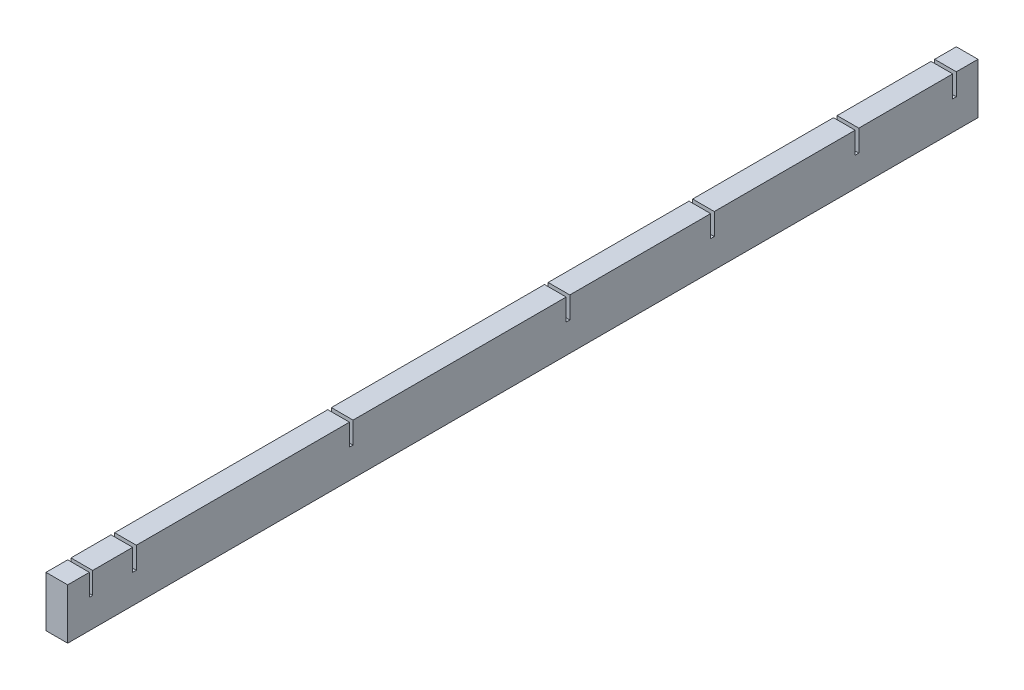
from build123d import *

# Parameters (mm, degrees)
BOSS_EXTRUDE1_DEPTH      = 1384.3
BOSS_EXTRUDE1_DEPTH_BACK = 215.9
SKETCH1_W                = 38.1
SKETCH1_H                = 88.9
SKETCH2_W                = 5.842
SKETCH2_H                = 38.1
SKETCH2_W_2              = 6.35
CUT_EXTRUDE1_DEPTH       = 1391.781379353


with BuildPart() as part:
    # Sketch1 → Boss-Extrude1 (new, two sides: drawn at the far end of the back side and taken through both)
    with BuildSketch(Plane.XY.offset(-BOSS_EXTRUDE1_DEPTH_BACK)):
        with Locations((0, 84.1375)):
            Rectangle(SKETCH1_W, SKETCH1_H)
    extrude(amount=BOSS_EXTRUDE1_DEPTH + BOSS_EXTRUDE1_DEPTH_BACK)

    # Sketch2 → Cut-Extrude1 (cut, through all)
    with BuildSketch(Plane(origin=(19.05, 0, 0), x_dir=(0, 0, -1), z_dir=(1, 0, 0))):
        with Locations((-1343.279, 109.5375)):
            Rectangle(SKETCH2_W, SKETCH2_H)
        with Locations((-1266.825, 109.5375)):
            Rectangle(SKETCH2_W_2, SKETCH2_H)
        with Locations((-885.825, 109.5375)):
            Rectangle(SKETCH2_W_2, SKETCH2_H)
        with Locations((-504.825, 109.5375)):
            Rectangle(SKETCH2_W_2, SKETCH2_H)
        with Locations((-250.825, 109.5375)):
            Rectangle(SKETCH2_W_2, SKETCH2_H)
        with Locations((3.175, 109.5375)):
            Rectangle(SKETCH2_W_2, SKETCH2_H)
        with Locations((174.625, 109.5375)):
            Rectangle(SKETCH2_W_2, SKETCH2_H)
    extrude(amount=-CUT_EXTRUDE1_DEPTH, mode=Mode.SUBTRACT)


solid = part.part
